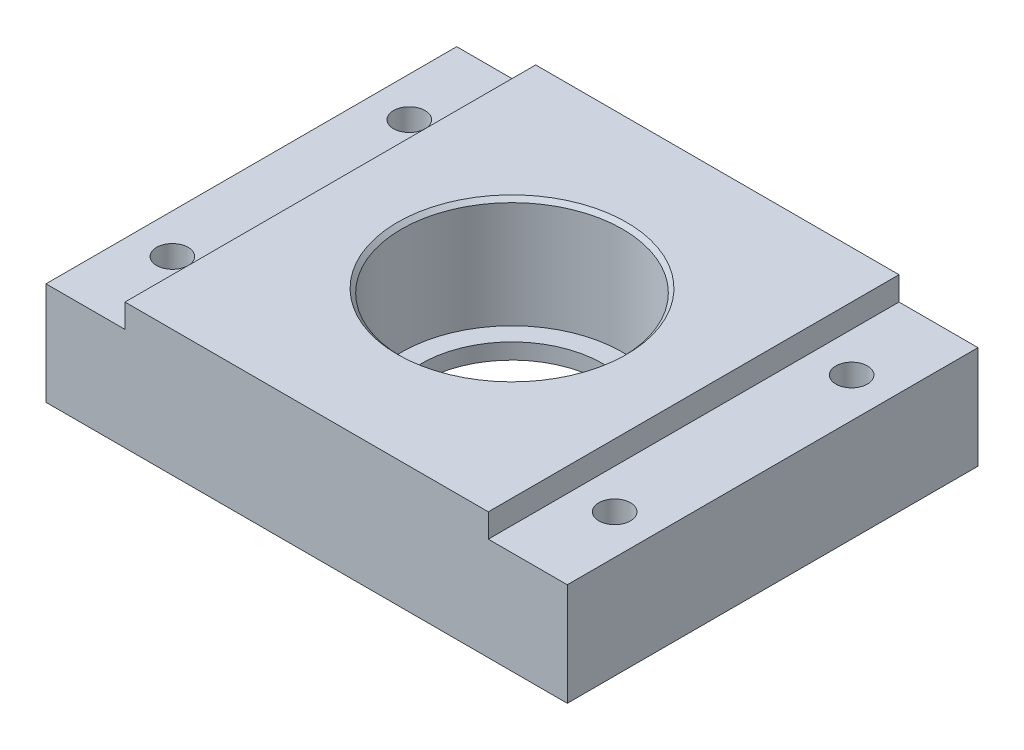
from build123d import *

# Parameters (mm, degrees)
SKETCH_1_W          = 50
SKETCH_1_H          = 52
SKETCH_1_R          = 14
EXTRUDE_1_DEPTH     = 16
SKETCH_2_R          = 14
SKETCH_2_R_2        = 11.5
EXTRUDE_2_DEPTH     = 2
SKETCH_3_W          = 8
SKETCH_3_H          = 13
EXTRUDE_3_DEPTH     = 52
SKETCH_4_R          = 2
CUT_EXTRUDE_1_DEPTH = 44.977266855
CHAMFER_1_SIZE      = 0.5
SKETCH_5_W          = 2
SKETCH_5_H          = 3
CUT_EXTRUDE_2_DEPTH = 64.63175308


with BuildPart() as part:
    # 草图1 → 凸台-拉伸1 (new body)
    with BuildSketch(Plane(origin=(0, 0, 0), x_dir=(1, 0, 0), z_dir=(0, 1, 0))):
        Rectangle(SKETCH_1_W, SKETCH_1_H)
        with Locations(Location((0, 0, 0), (0, 0, 270))):
            Circle(SKETCH_1_R, mode=Mode.SUBTRACT)
    extrude(amount=EXTRUDE_1_DEPTH)

    # 草图2 → 凸台-拉伸2 (add)
    with BuildSketch(Plane.XZ):
        with Locations(Location((0, 0, 0), (0, 0, 270))):
            Circle(SKETCH_2_R)
        with Locations(Location((0, 0, 0), (0, 0, 270))):
            Circle(SKETCH_2_R_2, mode=Mode.SUBTRACT)
    extrude(amount=-EXTRUDE_2_DEPTH)

    # 草图3 → 凸台-拉伸3 (add)
    with BuildSketch(Plane(origin=(0, 0, -26), x_dir=(-1, 0, 0), z_dir=(0, 0, -1))):
        with Locations((-29, 6.5)):
            Rectangle(SKETCH_3_W, SKETCH_3_H)
        with Locations((29, 6.5)):
            Rectangle(SKETCH_3_W, SKETCH_3_H)
    extrude(amount=-EXTRUDE_3_DEPTH)

    # 草图4 → 切除-拉伸1 (cut, through all)
    with BuildSketch(Plane(origin=(0, 13, 0), x_dir=(1, 0, 0), z_dir=(0, 1, 0))):
        with Locations(Location((-28, 15, 0), (0, 0, 180))):
            Circle(SKETCH_4_R)
        with Locations(Location((-28, -15, 0), (0, 0, 180))):
            Circle(SKETCH_4_R)
        with Locations(Location((28, 15, 0), (0, 0, 180))):
            Circle(SKETCH_4_R)
        with Locations(Location((28, -15, 0), (0, 0, 180))):
            Circle(SKETCH_4_R)
    extrude(amount=-CUT_EXTRUDE_1_DEPTH, mode=Mode.SUBTRACT)

    # 倒角1
    chamfer_1_edges = [part.edges().sort_by_distance(p)[0] for p in [
        (0, 16, -14),
    ]]
    chamfer(chamfer_1_edges, length=CHAMFER_1_SIZE)

    # 草图5 → 切除-拉伸2 (cut, through all)
    with BuildSketch(Plane.XY.offset(26)):
        with Locations((-24, 14.5)):
            Rectangle(SKETCH_5_W, SKETCH_5_H)
        with Locations((24, 14.5)):
            Rectangle(SKETCH_5_W, SKETCH_5_H)
    extrude(amount=-CUT_EXTRUDE_2_DEPTH, mode=Mode.SUBTRACT)


solid = part.part
